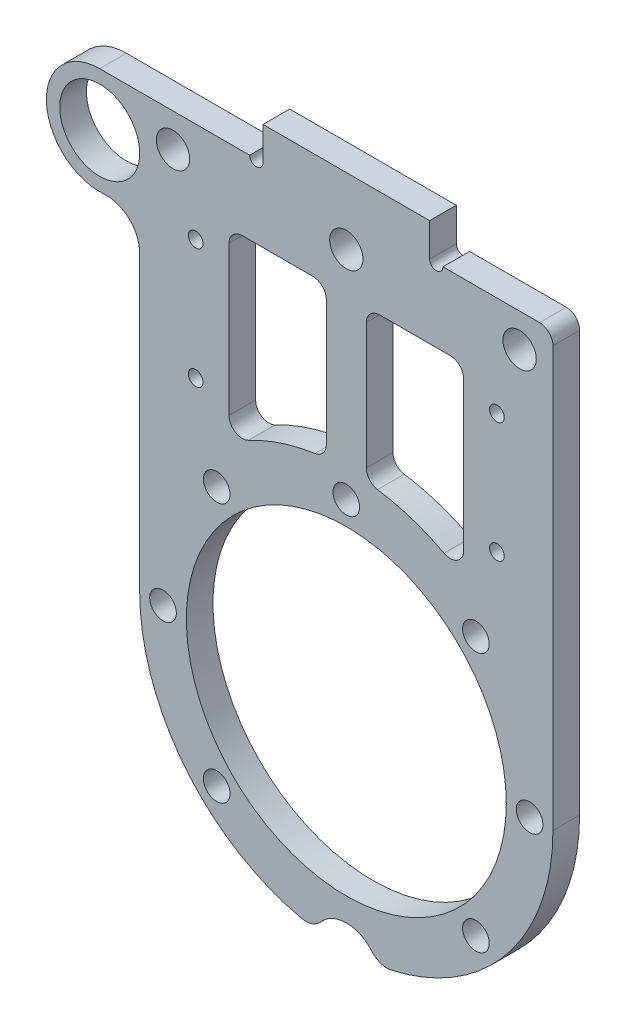
from build123d import *

# Parameters (mm, degrees)
SKETCH_1_R          = 24
SKETCH_1_R_2        = 2
SKETCH_1_R_3        = 2.5
SKETCH_1_R_4        = 1.1
SKETCH_1_R_5        = 6
EXTRUDE_1_DEPTH     = 4
SKETCH_2_R          = 1
CUT_EXTRUDE_1_DEPTH = 84.312664103
CUT_EXTRUDE_2_DEPTH = 10
FILLET_2_R          = 2
FILLET_3_R          = 2


with BuildPart() as part:
    # 草图1 → 凸台-拉伸1 (new body)
    with BuildSketch(Plane.XY):
        with BuildLine():
            Line((-31, 0), (-31, 44.038518603))
            ThreePointArc((-31, 44.038518603), (-32.603168898, 47.707515532), (-36.384615385, 49.023703756))
            ThreePointArc((-36.384615385, 49.023703756), (-44.994071865, 56.692079518), (-37, 65))
            Line((-37, 65), (-12.5, 65))
            Line((-12.5, 65), (-12.5, 70))
            Line((-12.5, 70), (12.5, 70))
            Line((12.5, 70), (12.5, 65))
            Line((12.5, 65), (31, 65))
            Line((31, 65), (31, 0))
            ThreePointArc((31, 0), (24.191352338, -19.385006373), (6.756227609, -30.254807692))
            ThreePointArc((6.756227609, -30.254807692), (5.147421514, -30.170867126), (3.813999457, -29.266826923))
            ThreePointArc((3.813999457, -29.266826923), (0, -27.5), (-3.813999457, -29.266826923))
            ThreePointArc((-3.813999457, -29.266826923), (-5.147421514, -30.170867126), (-6.756227609, -30.254807692))
            ThreePointArc((-6.756227609, -30.254807692), (-24.191352338, -19.385006373), (-31, 0))
        make_face()
        Circle(SKETCH_1_R, mode=Mode.SUBTRACT)
        with Locations((-19.445436483, 19.445436483)):
            Circle(SKETCH_1_R_2, mode=Mode.SUBTRACT)
        with Locations((0, 27.5)):
            Circle(SKETCH_1_R_2, mode=Mode.SUBTRACT)
        with Locations((19.445436483, 19.445436483)):
            Circle(SKETCH_1_R_2, mode=Mode.SUBTRACT)
        with Locations((27.5, 0)):
            Circle(SKETCH_1_R_2, mode=Mode.SUBTRACT)
        with Locations((19.445436483, -19.445436483)):
            Circle(SKETCH_1_R_2, mode=Mode.SUBTRACT)
        with Locations((-19.445436483, -19.445436483)):
            Circle(SKETCH_1_R_2, mode=Mode.SUBTRACT)
        with Locations((-27.5, 0)):
            Circle(SKETCH_1_R_2, mode=Mode.SUBTRACT)
        with Locations((-26, 60)):
            Circle(SKETCH_1_R_3, mode=Mode.SUBTRACT)
        with Locations((0, 60)):
            Circle(SKETCH_1_R_3, mode=Mode.SUBTRACT)
        with Locations((26, 60)):
            Circle(SKETCH_1_R_3, mode=Mode.SUBTRACT)
        with Locations((-22.6, 50)):
            Circle(SKETCH_1_R_4, mode=Mode.SUBTRACT)
        with Locations((-22.6, 32)):
            Circle(SKETCH_1_R_4, mode=Mode.SUBTRACT)
        with Locations((22.6, 32)):
            Circle(SKETCH_1_R_4, mode=Mode.SUBTRACT)
        with Locations((22.6, 50)):
            Circle(SKETCH_1_R_4, mode=Mode.SUBTRACT)
        with Locations((-37, 57)):
            Circle(SKETCH_1_R_5, mode=Mode.SUBTRACT)
    extrude(amount=EXTRUDE_1_DEPTH)

    # 草图2 → 切除-拉伸1 (cut, through all)
    with BuildSketch(Plane.XY.offset(4)):
        with Locations((-13.5, 65)):
            Circle(SKETCH_2_R)
        with Locations((13.5, 65)):
            Circle(SKETCH_2_R)
    extrude(amount=-CUT_EXTRUDE_1_DEPTH, mode=Mode.SUBTRACT)

    # 草图3 → 切除-拉伸2 (cut)
    with BuildSketch(Plane.XY.offset(4)):
        with BuildLine():
            Line((-3, 54), (-17.6, 54))
            Line((-17.6, 54), (-17.6, 26.124509565))
            ThreePointArc((-17.6, 26.124509565), (-10.627053281, 29.653258482), (-3, 31.356817441))
            Line((-3, 31.356817441), (-3, 54))
        make_face()
        with BuildLine():
            Line((17.6, 54), (3, 54))
            Line((3, 54), (3, 31.356817441))
            ThreePointArc((3, 31.356817441), (10.627053281, 29.653258482), (17.6, 26.124509565))
            Line((17.6, 26.124509565), (17.6, 54))
        make_face()
    extrude(amount=-CUT_EXTRUDE_2_DEPTH, mode=Mode.SUBTRACT)

    # 圆角2
    fillet_2_edges = [part.edges().sort_by_distance(p)[0] for p in [
        (-3, 31.356817441, 2),
        (-17.6, 26.124509565, 2),
        (-17.6, 54, 2),
        (-3, 54, 2),
        (17.6, 26.124509565, 2),
        (3, 31.356817441, 2),
        (3, 54, 2),
        (17.6, 54, 2),
    ]]
    fillet(fillet_2_edges, radius=FILLET_2_R)

    # 圆角3
    fillet_3_edges = [part.edges().sort_by_distance(p)[0] for p in [
        (31, 65, 2),
    ]]
    fillet(fillet_3_edges, radius=FILLET_3_R)


solid = part.part
